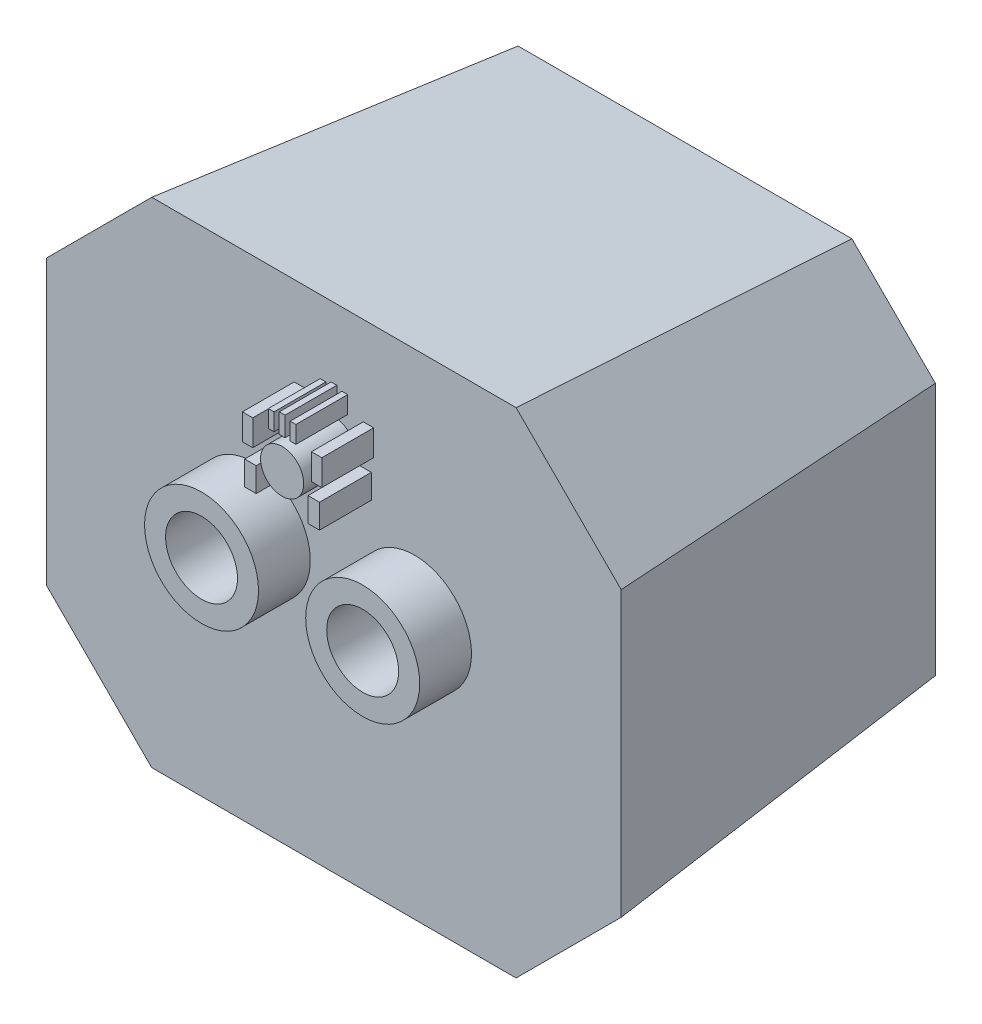
from build123d import *

# Parameters (mm, degrees)
SKETCH1_R           = 12.5
BOSS_EXTRUDE1_DEPTH = 122
BOSS_EXTRUDE1_DRAFT = -6
SKETCH2_R           = 19.8
SKETCH2_R_2         = 12.5
SKETCH2_R_3         = 7.5
SKETCH2_W           = 2
SKETCH2_H           = 6
SKETCH2_H_2         = 6.8
SKETCH2_W_2         = 3.6
SKETCH2_H_3         = 9
SKETCH2_W_3         = 4
SKETCH2_H_4         = 8.4
BOSS_EXTRUDE2_DEPTH = 140


with BuildPart() as part:
    # Sketch1 → Boss-Extrude1 (with draft: the straight prism first)
    with BuildSketch(Plane.XY):
        Polygon((-58, 73), (-87, 44), (-87, -44), (-58, -73), (58, -73), (87, -44), (87, 44), (58, 73), align=None)
        with Locations((-28, 4)):
            Circle(SKETCH1_R, mode=Mode.SUBTRACT)
        with Locations((28, 4)):
            Circle(SKETCH1_R, mode=Mode.SUBTRACT)
    extrude(amount=BOSS_EXTRUDE1_DEPTH)
    # Boss-Extrude1: the draft: its side faces are tilted about the plane it starts from
    boss_extrude1_sides = [part.faces().sort_by_distance(p)[0] for p in [
        (-72.5, 58.5, 61),
        (-87, 0, 61),
        (-72.5, -58.5, 61),
        (0, -73, 61),
        (72.5, -58.5, 61),
        (87, 0, 61),
        (72.5, 58.5, 61),
        (0, 73, 61),
        (-40.5, 4, 61),
        (15.5, 4, 61),
    ]]
    draft(boss_extrude1_sides, Plane.XY, BOSS_EXTRUDE1_DRAFT)

    # Sketch2 → Boss-Extrude2 (add)
    # profile 1 of 10: a face of its own
    with BuildSketch(Plane.XY):
        with Locations(Location((-28, 4, 0), (0, 0, 180))):
            Circle(SKETCH2_R)
        with Locations(Location((-28, 4, 0), (0, 0, 180))):
            Circle(SKETCH2_R_2, mode=Mode.SUBTRACT)
    # profile 2 of 10: a face of its own
    with BuildSketch(Plane.XY):
        with Locations(Location((28, 4, 0), (0, 0, 180))):
            Circle(SKETCH2_R)
        with Locations(Location((28, 4, 0), (0, 0, 180))):
            Circle(SKETCH2_R_2, mode=Mode.SUBTRACT)
    # profile 3 of 10: a face of its own
    with BuildSketch(Plane.XY):
        with Locations(Location((0, 44, 0), (0, 0, 180))):
            Circle(SKETCH2_R_3)
    # profile 4 of 10: a face of its own
    with BuildSketch(Plane.XY):
        with Locations((-3.8, 57.5)):
            Rectangle(SKETCH2_W, SKETCH2_H)
    # profile 5 of 10: a face of its own
    with BuildSketch(Plane.XY):
        with Locations((0, 58)):
            Rectangle(SKETCH2_W, SKETCH2_H_2)
    # profile 6 of 10: a face of its own
    with BuildSketch(Plane.XY):
        with Locations((3.8, 57.5)):
            Rectangle(SKETCH2_W, SKETCH2_H)
    # profile 7 of 10: a face of its own
    with BuildSketch(Plane.XY):
        with Locations((-12, 50.5)):
            Rectangle(SKETCH2_W_2, SKETCH2_H_3)
    # profile 8 of 10: a face of its own
    with BuildSketch(Plane.XY):
        with Locations((12, 50.5)):
            Rectangle(SKETCH2_W_2, SKETCH2_H_3)
    # profile 9 of 10: a face of its own
    with BuildSketch(Plane.XY):
        with Locations((-11, 37)):
            Rectangle(SKETCH2_W_3, SKETCH2_H_4)
    # profile 10 of 10: a face of its own
    with BuildSketch(Plane.XY):
        with Locations((11, 37)):
            Rectangle(SKETCH2_W_3, SKETCH2_H_4)
    extrude(amount=BOSS_EXTRUDE2_DEPTH)


solid = part.part
